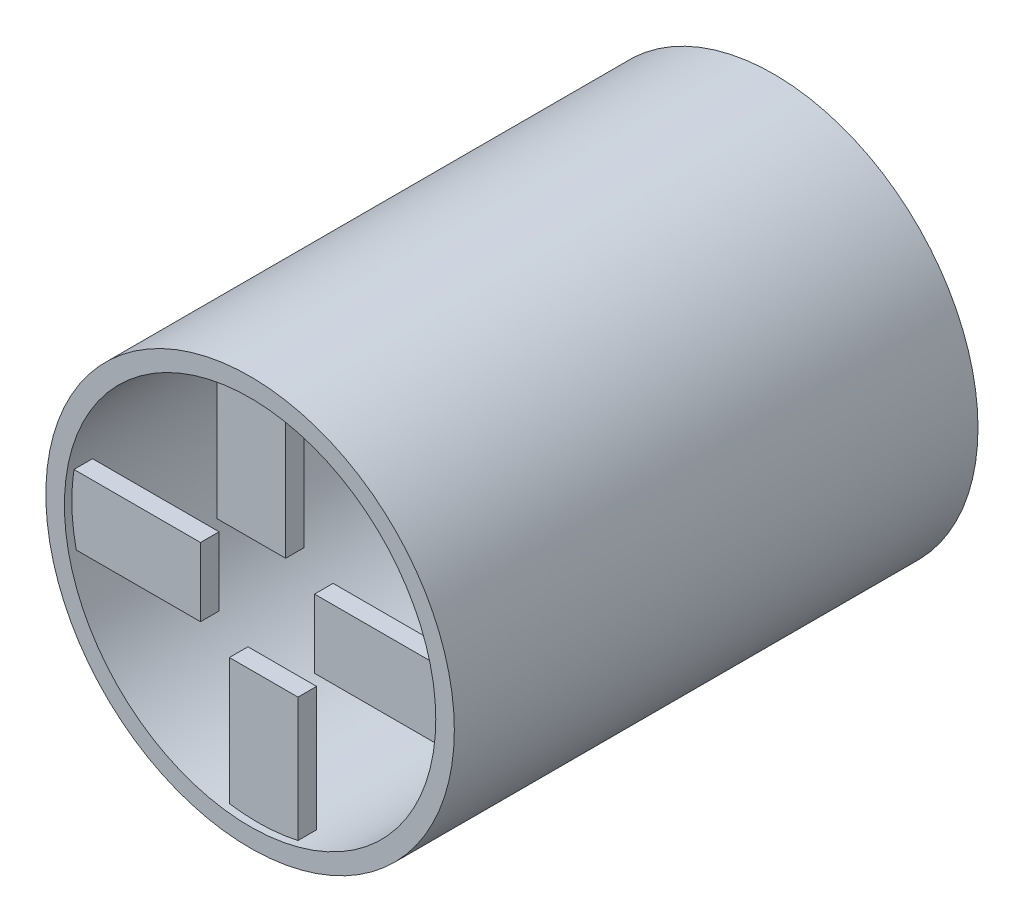
from build123d import *
from build123d.topology import SkipClean

# Parameters (mm, degrees)
ESQUISSE1_R        = 2.749689511
ESQUISSE1_R_2      = 2.5
BOSS_EXTRU_1_DEPTH = 6.7
ESQUISSE2_R        = 2.749689511
BOSS_EXTRU_2_DEPTH = 0.25
ESQUISSE3_R        = 2.749689511
ESQUISSE3_R_2      = 2.5
BOSS_EXTRU_4_DEPTH = 0.1


with BuildPart() as part:
    # Esquisse1 → Boss.-Extru.1 (new body)
    with BuildSketch(Plane.XY):
        Circle(ESQUISSE1_R)
        Circle(ESQUISSE1_R_2, mode=Mode.SUBTRACT)
    extrude(amount=BOSS_EXTRU_1_DEPTH)

    # Esquisse2 → Boss.-Extru.2 (add)
    with SkipClean():  # the faces are left unmerged after this step: merging them gives an invalid solid
        with BuildSketch(Plane.XY.offset(6.7)):
            Circle(ESQUISSE2_R)
            with BuildLine():
                Line((2.439891921, 0.544910465), (0.767744305, 0.544910465))
                Line((0.767744305, 0.544910465), (0.767744305, -0.378691706))
                Line((0.767744305, -0.378691706), (2.471152078, -0.378691706))
                ThreePointArc((2.471152078, -0.378691706), (1.826552736, -1.70695785), (0.544910465, -2.439891921))
                Line((0.544910465, -2.439891921), (0.544910465, -0.767744305))
                Line((0.544910465, -0.767744305), (-0.378691706, -0.767744305))
                Line((-0.378691706, -0.767744305), (-0.378691706, -2.471152078))
                ThreePointArc((-0.378691706, -2.471152078), (-1.70695785, -1.826552736), (-2.439891921, -0.544910465))
                Line((-2.439891921, -0.544910465), (-0.767744305, -0.544910465))
                Line((-0.767744305, -0.544910465), (-0.767744305, 0.378691706))
                Line((-0.767744305, 0.378691706), (-2.471152078, 0.378691706))
                ThreePointArc((-2.471152078, 0.378691706), (-1.826552736, 1.70695785), (-0.544910465, 2.439891921))
                Line((-0.544910465, 2.439891921), (-0.544910465, 0.767744305))
                Line((-0.544910465, 0.767744305), (0.378691706, 0.767744305))
                Line((0.378691706, 0.767744305), (0.378691706, 2.471152078))
                ThreePointArc((0.378691706, 2.471152078), (1.70695785, 1.826552736), (2.439891921, 0.544910465))
            make_face(mode=Mode.SUBTRACT)
        extrude(amount=BOSS_EXTRU_2_DEPTH)

    # Esquisse3 → Boss.-Extru.4 (add)
    with SkipClean():  # the faces are left unmerged after this step: merging them gives an invalid solid
        with BuildSketch(Plane.XY.offset(6.95)):
            Circle(ESQUISSE3_R)
            Circle(ESQUISSE3_R_2, mode=Mode.SUBTRACT)
        extrude(amount=BOSS_EXTRU_4_DEPTH)


solid = part.part
